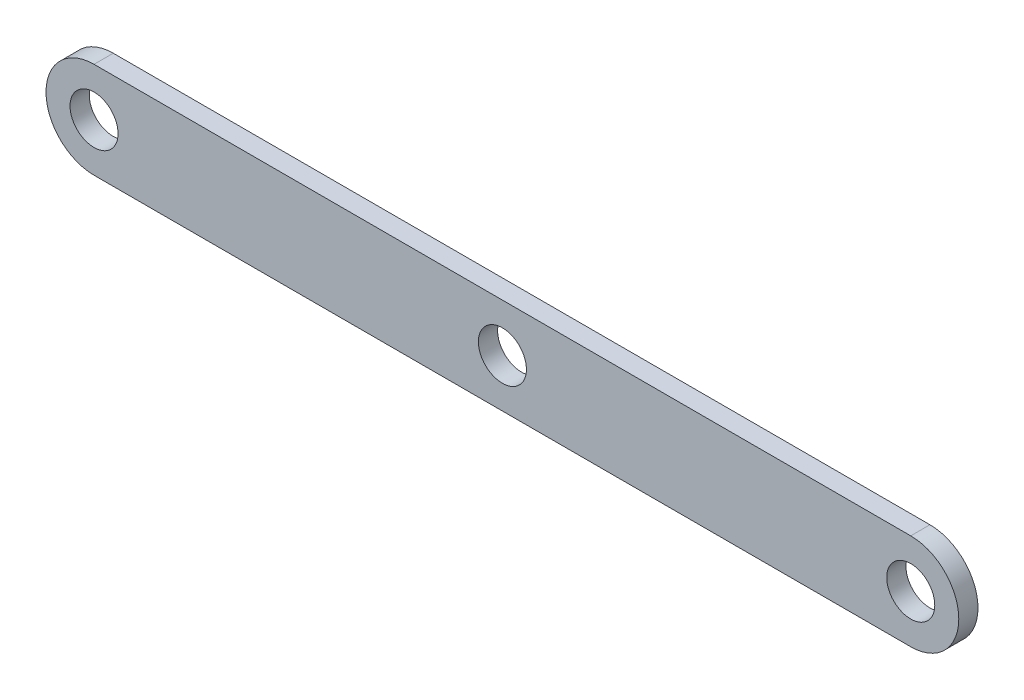
from build123d import *

# Parameters (mm, degrees)
SKETCH_1_R      = 2.5
EXTRUDE_1_DEPTH = 2


with BuildPart() as part:
    # 草图1 → 凸台-拉伸1 (new body)
    with BuildSketch(Plane.XY):
        with BuildLine():
            Line((-42.5, -5), (42.5, -5))
            ThreePointArc((42.5, -5), (47.5, 0), (42.5, 5))
            Line((42.5, 5), (-42.5, 5))
            ThreePointArc((-42.5, 5), (-47.5, 0), (-42.5, -5))
        make_face()
        with Locations((-42.5, 0)):
            Circle(SKETCH_1_R, mode=Mode.SUBTRACT)
        with Locations((42.5, 0)):
            Circle(SKETCH_1_R, mode=Mode.SUBTRACT)
        Circle(SKETCH_1_R, mode=Mode.SUBTRACT)
    extrude(amount=EXTRUDE_1_DEPTH)


solid = part.part
